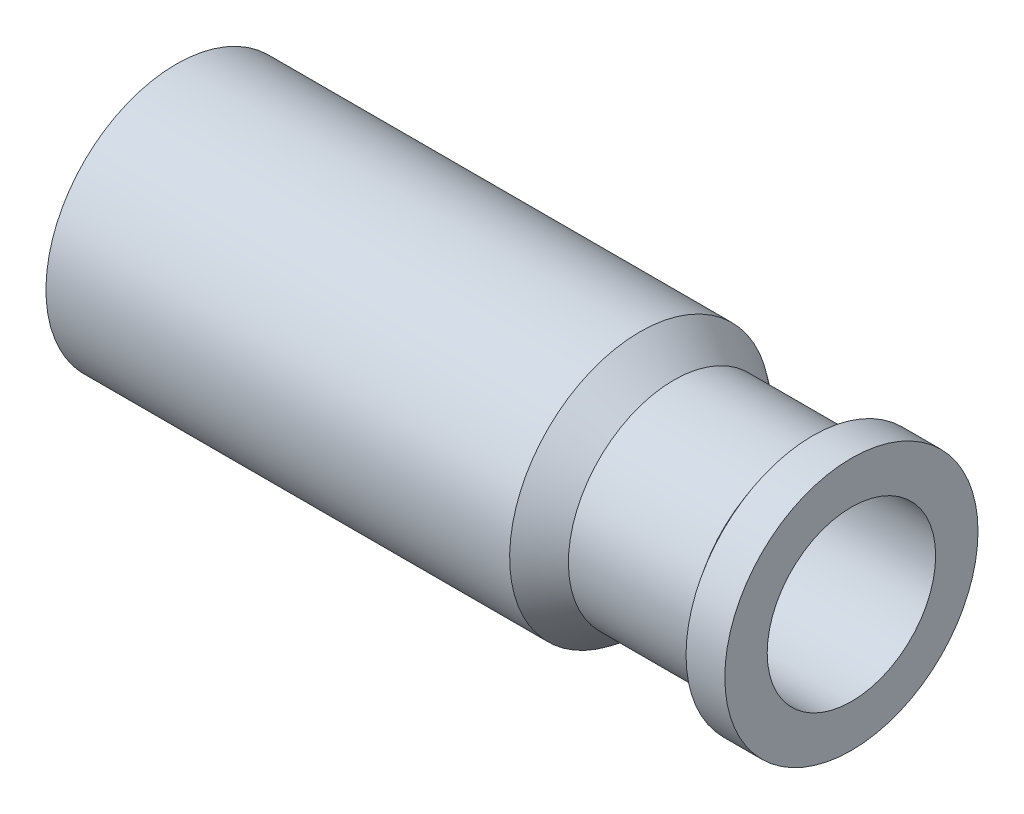
from build123d import *

# Parameters (mm, degrees)
SKETCH4_R          = 25.350124824
CUT_EXTRUDE1_DEPTH = 190.5


with BuildPart() as part:
    # Sketch1 → Revolve1 (revolve)
    with BuildSketch(Plane.XY):
        Polygon((107.503032851, -15.910925594), (117.715228697, -23.386149331), (154.81866926, -23.386149331), (159.466804827, -17.036149331), (171.145497316, -17.036149331), (171.145497316, -55.136149331), (-32.054502684, -55.136149331), (-32.054502684, -15.910925594), align=None)
    revolve(axis=Axis((171.145497316, -55.136149331, 0), (-1, 0, 0)))

    # Sketch4 → Cut-Extrude1 (cut)
    with BuildSketch(Plane(origin=(171.145497316, 0, 0), x_dir=(0, 0, -1), z_dir=(1, 0, 0))):
        with Locations(Location((0, -55.136149331, 0), (0, 0, 90))):
            Circle(SKETCH4_R)
    extrude(amount=-CUT_EXTRUDE1_DEPTH, mode=Mode.SUBTRACT)


solid = part.part
